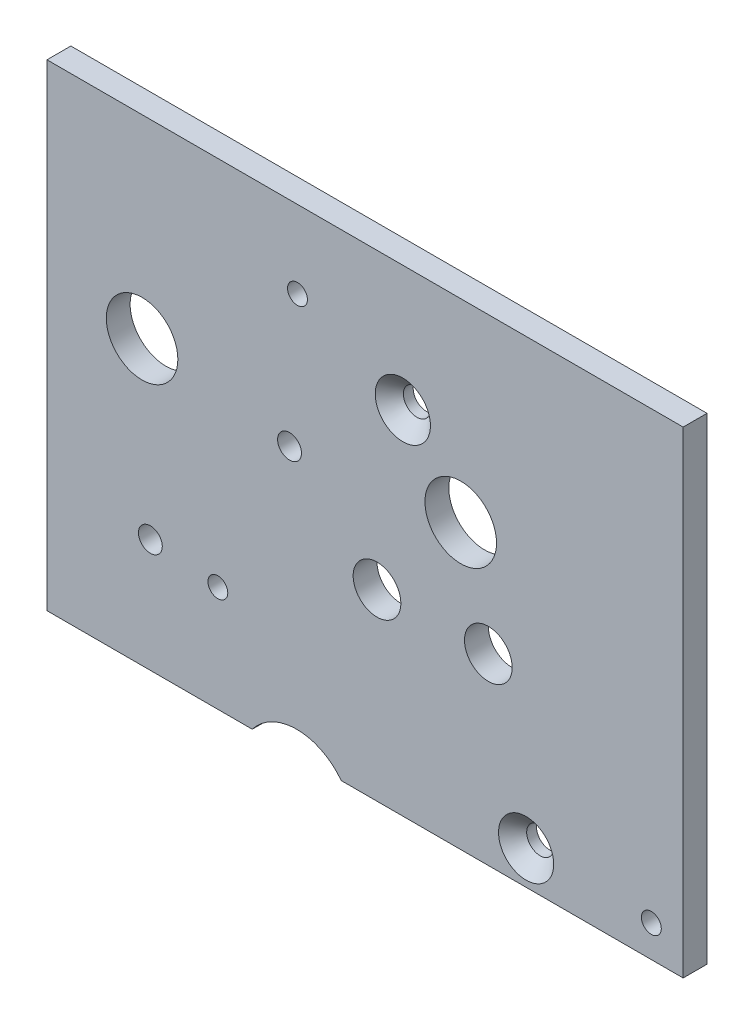
from build123d import *

# Parameters (mm, degrees)
SKETCH_1_R                                   = 3
SKETCH_1_R_2                                 = 4.5
EXTRUDE_1_DEPTH                              = 3
CSK_FOR_M3_HEX_SOCKET_COUNTERSUNK_HE_2_COUNT = 2
CSK_FOR_M3_HEX_SOCKET_COUNTERSUNK_HE_2_PITCH = 42.898135158
SKETCH_2_R                                   = 1.5
SKETCH_2_R_2                                 = 1.25
CUT_EXTRUDE1_DEPTH                           = 10
SKETCH4_R                                    = 1.25
CUT_EXTRUDE2_DEPTH                           = 3


with BuildPart() as part:
    # Эскиз1 → Бобышка-Вытянуть1 (new body)
    with BuildSketch(Plane.XY.offset(53.2)):
        with BuildLine():
            Line((-4.102180416, 226.353254388), (38.893407272, 226.353254388))
            Line((38.893407272, 226.353254388), (38.893407272, 286.353254388))
            Line((38.893407272, 286.353254388), (-41.106592728, 286.353254388))
            Line((-41.106592728, 286.353254388), (-41.106592728, 226.353254388))
            Line((-41.106592728, 226.353254388), (-15.28891158, 226.353254388))
            ThreePointArc((-15.28891158, 226.353254388), (-9.695545998, 229.144425829), (-4.102180416, 226.353254388))
        make_face()
        with Locations((0.393407272, 249.403254388)):
            Circle(SKETCH_1_R, mode=Mode.SUBTRACT)
        with Locations((14.393407272, 249.403254388)):
            Circle(SKETCH_1_R, mode=Mode.SUBTRACT)
        with Locations((-29.150473778, 261.95614373)):
            Circle(SKETCH_1_R_2, mode=Mode.SUBTRACT)
        with Locations((10.923063266, 261.985726175)):
            Circle(SKETCH_1_R_2, mode=Mode.SUBTRACT)
    extrude(amount=EXTRUDE_1_DEPTH)

    # Sketch3 → CSK for M3 Hex Socket Countersunk Head Screw1 (revolve, cut)
    with BuildSketch(Plane(origin=(3.643407272, 270.603254388, 56.2), x_dir=(0, -1, 0), z_dir=(1, 0, 0))):
        Polygon((0, 0), (0, 3), (1.7, 3), (1.7, 1.77), (3.47, 0), align=None)
    csk_for_m3_hex_socket_countersunk_head_s = revolve(axis=Axis((3.643407272, 270.603254388, 62.55), (0, 0, -1)), mode=Mode.SUBTRACT)

    # CSK for M3 Hex Socket Countersunk He 2: CSK for M3 Hex Socket Countersunk Head Screw1 ×2
    with Locations(*[Vector(0.36132106775864725, -0.9324414651836066, 0) * (i * CSK_FOR_M3_HEX_SOCKET_COUNTERSUNK_HE_2_PITCH) for i in range(1, CSK_FOR_M3_HEX_SOCKET_COUNTERSUNK_HE_2_COUNT)]):
        add(csk_for_m3_hex_socket_countersunk_head_s, mode=Mode.SUBTRACT)

    # Эскиз2 → Cut-Extrude1 (cut)
    with BuildSketch(Plane.XY.offset(56.2)):
        with Locations((-28.106592728, 240.603254388)):
            Circle(SKETCH_2_R)
        with Locations((-10.606592728, 259.503254388)):
            Circle(SKETCH_2_R)
        with Locations((3.643407272, 270.603254388)):
            Circle(SKETCH_2_R_2)
        with Locations((19.143407272, 230.603254388)):
            Circle(SKETCH_2_R_2)
    extrude(amount=-CUT_EXTRUDE1_DEPTH, mode=Mode.SUBTRACT)

    # Sketch4 → Cut-Extrude2 (cut)
    with BuildSketch(Plane.XY.offset(56.2)):
        with Locations((-9.606592728, 276.603254388)):
            Circle(SKETCH4_R)
        with Locations((-19.620743586, 239.653254388)):
            Circle(SKETCH4_R)
        with Locations((34.893407272, 230.353254388)):
            Circle(SKETCH4_R)
    extrude(amount=-CUT_EXTRUDE2_DEPTH, mode=Mode.SUBTRACT)


solid = part.part
